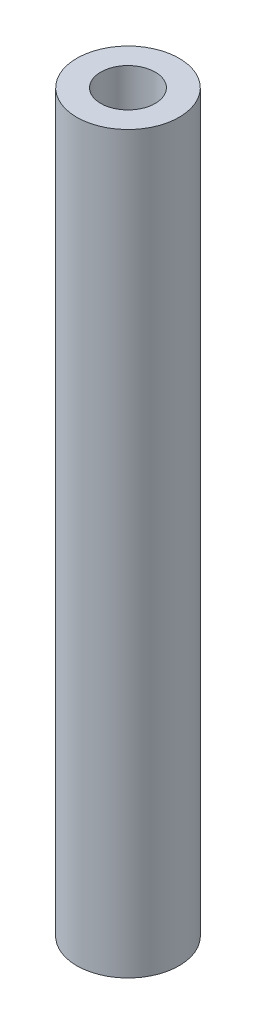
from build123d import *

# Parameters (mm, degrees)
SKETCH1_R           = 9.398
SKETCH1_R_2         = 5
BOSS_EXTRUDE1_DEPTH = 135


with BuildPart() as part:
    # Sketch1 → Boss-Extrude1 (new body)
    with BuildSketch(Plane(origin=(0, 0, 0), x_dir=(1, 0, 0), z_dir=(0, 1, 0))):
        with Locations(Location((0, 0, 0), (0, 0, 270))):
            Circle(SKETCH1_R)
        with Locations(Location((0, 0, 0), (0, 0, 270))):
            Circle(SKETCH1_R_2, mode=Mode.SUBTRACT)
    extrude(amount=BOSS_EXTRUDE1_DEPTH)


solid = part.part
